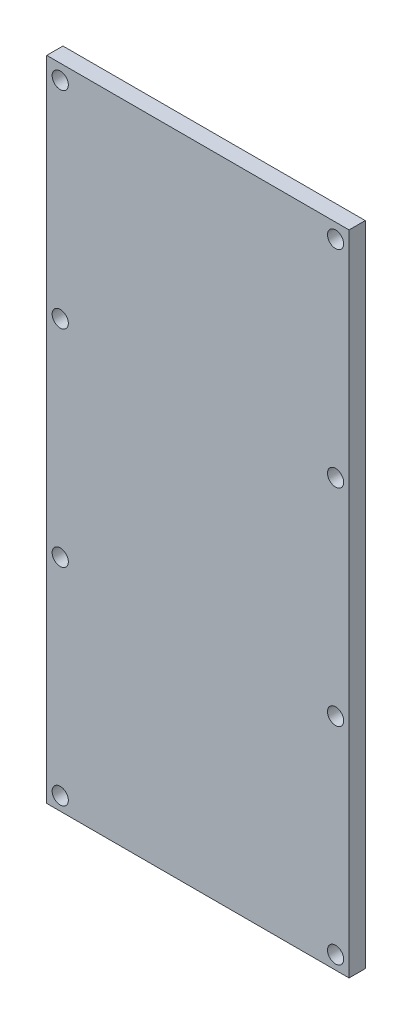
from build123d import *

# Parameters (mm, degrees)
SKICA1_W                = 56
SKICA1_H                = 120
SKICA1_R                = 1.5
P_IDAT_VYSUNUT_M1_DEPTH = 3
SKICA2_W                = 46
SKICA2_H                = 110
SKICA2_W_2              = 43
SKICA2_H_2              = 107
P_IDAT_VYSUNUT_M2_DEPTH = 6


with BuildPart() as part:
    # Skica1 → Přidat vysunutím1 (new body)
    with BuildSketch(Plane.XY):
        with Locations((-86, 47)):
            Rectangle(SKICA1_W, SKICA1_H)
        with Locations((-60.5, -10.5)):
            Circle(SKICA1_R, mode=Mode.SUBTRACT)
        with Locations((-111.5, -10.5)):
            Circle(SKICA1_R, mode=Mode.SUBTRACT)
        with Locations((-111.5, 27.75)):
            Circle(SKICA1_R, mode=Mode.SUBTRACT)
        with Locations((-111.5, 66)):
            Circle(SKICA1_R, mode=Mode.SUBTRACT)
        with Locations((-111.5, 104.25)):
            Circle(SKICA1_R, mode=Mode.SUBTRACT)
        with Locations((-60.5, 27.75)):
            Circle(SKICA1_R, mode=Mode.SUBTRACT)
        with Locations((-60.5, 66)):
            Circle(SKICA1_R, mode=Mode.SUBTRACT)
        with Locations((-60.5, 104.25)):
            Circle(SKICA1_R, mode=Mode.SUBTRACT)
    extrude(amount=P_IDAT_VYSUNUT_M1_DEPTH)

    # Skica2 → Přidat vysunutím2 (add)
    with BuildSketch(Plane.XY.offset(3)):
        with Locations((-86, 47)):
            Rectangle(SKICA2_W, SKICA2_H)
        with Locations((-86, 47)):
            Rectangle(SKICA2_W_2, SKICA2_H_2, mode=Mode.SUBTRACT)
    extrude(amount=-P_IDAT_VYSUNUT_M2_DEPTH)


solid = part.part
